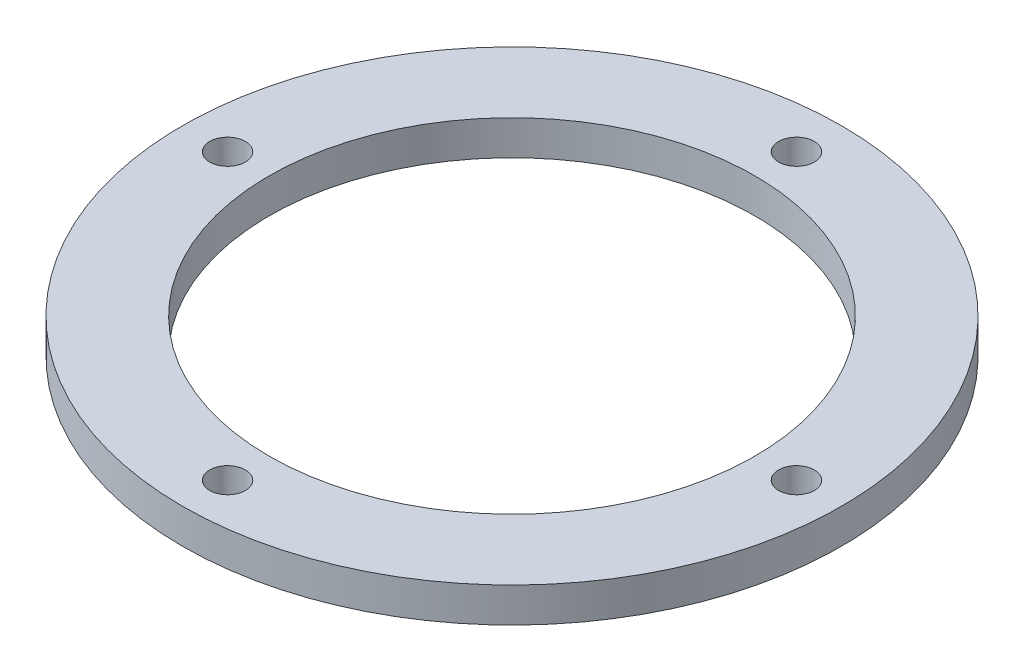
from build123d import *

# Parameters (mm, degrees)
SKETCH_1_R          = 47.5
SKETCH_1_R_2        = 35
EXTRUDE_1_DEPTH     = 5
CUT_EXTRUDE_1_REACH = 69.361
SKETCH_2_R          = 2.575


with BuildPart() as part:
    # 草图1 → 凸台-拉伸1 (new body)
    with BuildSketch(Plane(origin=(0, 0, 0), x_dir=(1, 0, 0), z_dir=(0, 1, 0))):
        with Locations(Location((0, 0, 0), (0, 0, 270))):
            Circle(SKETCH_1_R)
        with Locations(Location((0, 0, 0), (0, 0, 270))):
            Circle(SKETCH_1_R_2, mode=Mode.SUBTRACT)
    extrude(amount=EXTRUDE_1_DEPTH)

    # 草图2 → 切除-拉伸1 (cut, up to next)
    with BuildSketch(Plane(origin=(0, 5, 0), x_dir=(1, 0, 0), z_dir=(0, 1, 0)), mode=Mode.PRIVATE) as cut_extrude_1_sk1:
        with Locations(Location((0, 41, 0), (0, 0, 270))):
            Circle(SKETCH_2_R)
    cut_extrude_1_tool1 = extrude(cut_extrude_1_sk1.sketch, amount=-CUT_EXTRUDE_1_REACH, mode=Mode.PRIVATE) & part.part
    # 草图2 → 切除-拉伸1 (cut, up to next)
    with BuildSketch(Plane(origin=(0, 5, 0), x_dir=(1, 0, 0), z_dir=(0, 1, 0)), mode=Mode.PRIVATE) as cut_extrude_1_sk2:
        with Locations(Location((41, 0, 0), (0, 0, 270))):
            Circle(SKETCH_2_R)
    cut_extrude_1_tool2 = extrude(cut_extrude_1_sk2.sketch, amount=-CUT_EXTRUDE_1_REACH, mode=Mode.PRIVATE) & part.part
    # 草图2 → 切除-拉伸1 (cut, up to next)
    with BuildSketch(Plane(origin=(0, 5, 0), x_dir=(1, 0, 0), z_dir=(0, 1, 0)), mode=Mode.PRIVATE) as cut_extrude_1_sk3:
        with Locations(Location((0, -41, 0), (0, 0, 270))):
            Circle(SKETCH_2_R)
    cut_extrude_1_tool3 = extrude(cut_extrude_1_sk3.sketch, amount=-CUT_EXTRUDE_1_REACH, mode=Mode.PRIVATE) & part.part
    # 草图2 → 切除-拉伸1 (cut, up to next)
    with BuildSketch(Plane(origin=(0, 5, 0), x_dir=(1, 0, 0), z_dir=(0, 1, 0)), mode=Mode.PRIVATE) as cut_extrude_1_sk4:
        with Locations(Location((-41, 0, 0), (0, 0, 270))):
            Circle(SKETCH_2_R)
    cut_extrude_1_tool4 = extrude(cut_extrude_1_sk4.sketch, amount=-CUT_EXTRUDE_1_REACH, mode=Mode.PRIVATE) & part.part
    add(cut_extrude_1_tool1.solids().sort_by_distance((0, 5, -41))[0], mode=Mode.SUBTRACT)
    add(cut_extrude_1_tool2.solids().sort_by_distance((41, 5, 0))[0], mode=Mode.SUBTRACT)
    add(cut_extrude_1_tool3.solids().sort_by_distance((0, 5, 41))[0], mode=Mode.SUBTRACT)
    add(cut_extrude_1_tool4.solids().sort_by_distance((-41, 5, 0))[0], mode=Mode.SUBTRACT)


solid = part.part
